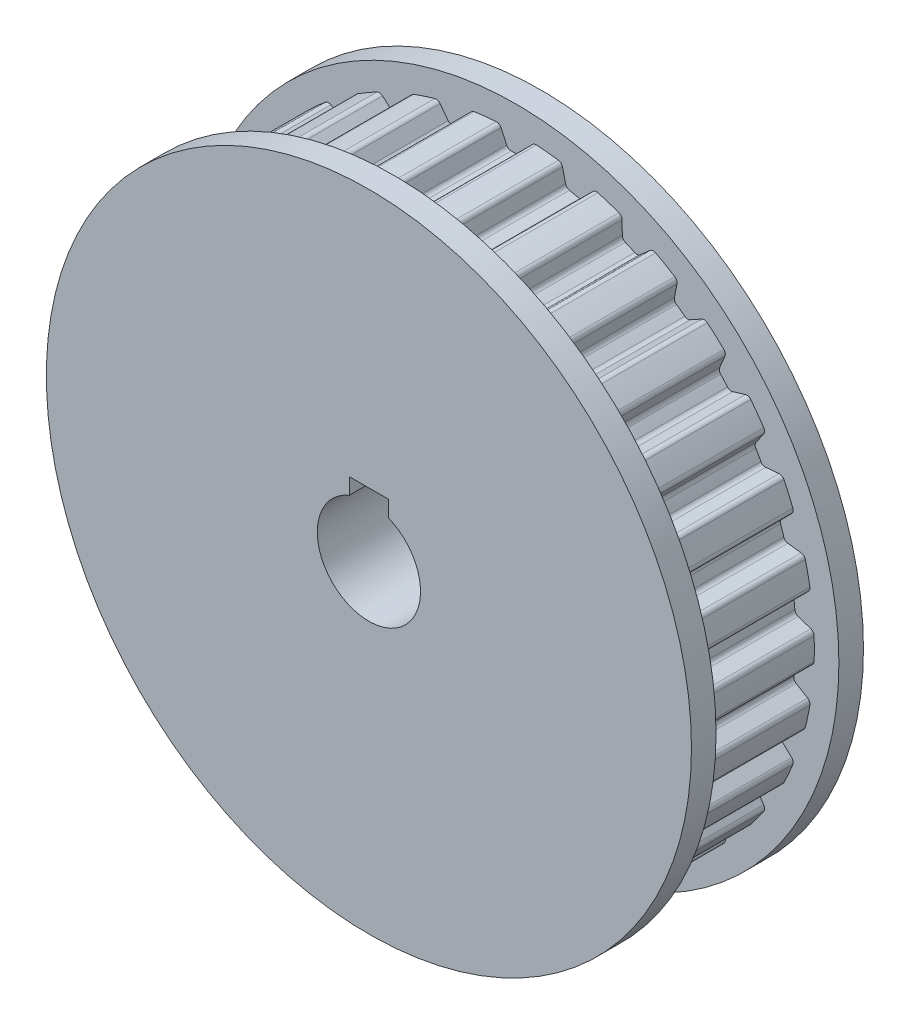
from build123d import *

# Parameters (mm, degrees)
CUT_EXTRUDE4_REACH             = 39.785
CUT_EXTRUDE4_DIRECTION_2_REACH = 39.785
CIRPATTERN1_COUNT              = 30
SKETCH2_R                      = 4.2
CUT_EXTRUDE1_DEPTH             = 40.682142756
SKETCH7_W                      = 3.2
SKETCH7_H                      = 5.2
CUT_EXTRUDE5_DEPTH             = 40.682142756
SKETCH3_R                      = 1.25
CUT_EXTRUDE2_DEPTH             = 40.682142756
SKETCH4_R                      = 1.25
CUT_EXTRUDE3_DEPTH             = 40.682142791


with BuildPart() as part:
    # Sketch1 → Revolve1 (revolve)
    with BuildSketch(Plane(origin=(0, 0, 0), x_dir=(1, 0, 0), z_dir=(0, 1, 0)), mode=Mode.PRIVATE) as revolve1_sk:
        Polygon((0, 14), (-26.255213327, 14), (-26.255213327, 12), (-24.255213327, 12), (-24.255213327, 2), (-26.255213327, 2), (-26.255213327, 0), (0, 0), align=None)
    revolve(revolve1_sk.sketch.rotate(Axis((0, 0, 0), (0, 0, -1)), 180), axis=Axis((0, 0, 0), (0, 0, -1)))

    # Cut-Extrude4: up to this face of the body (flat: up to its plane)
    cut_extrude4_end = Plane(part.part.faces().sort_by_distance((-25.512603752, 0, -12))[0])
    # Sketch6 → Cut-Extrude4 (cut, up to the picked face)
    with BuildSketch(Plane.XY.offset(-7), mode=Mode.PRIVATE) as cut_extrude4_sk1:
        with BuildLine():
            Line((-0.7897042, 22.982225242), (-1.250165079, 23.969686785))
            ThreePointArc((-1.250165079, 23.969686785), (-1.40930102, 24.14507185), (-1.639729464, 24.199724396))
            ThreePointArc((-1.639729464, 24.199724396), (0, 24.255213327), (1.639729464, 24.199724396))
            ThreePointArc((1.639729464, 24.199724396), (1.40930102, 24.14507185), (1.250165079, 23.969686785))
            Line((1.250165079, 23.969686785), (0.7897042, 22.982225242))
            ThreePointArc((0.7897042, 22.982225242), (0.638979774, 22.811947754), (0.419801648, 22.751340623))
            ThreePointArc((0.419801648, 22.751340623), (0, 22.755213327), (-0.419801648, 22.751340623))
            ThreePointArc((-0.419801648, 22.751340623), (-0.638979774, 22.811947754), (-0.7897042, 22.982225242))
        make_face()
    cut_extrude4_tool1 = split(extrude(cut_extrude4_sk1.sketch, amount=-CUT_EXTRUDE4_REACH, mode=Mode.PRIVATE), bisect_by=cut_extrude4_end, keep=Keep.BOTH, mode=Mode.PRIVATE)
    cut_extrude4 = cut_extrude4_tool1.solids().sort_by(Axis((0, 23.592076, -7), (0, 0, -1)))[0]
    add(cut_extrude4, mode=Mode.SUBTRACT)

    # Cut-Extrude4 direction 2: up to this face of the body (flat: up to its plane)
    cut_extrude4_direction_2_end = Plane(part.part.faces().sort_by_distance((-24.997822903, 0, -2))[0])
    # Sketch6 → Cut-Extrude4 direction 2 (cut, up to the picked face)
    with BuildSketch(Plane.XY.offset(-7), mode=Mode.PRIVATE) as cut_extrude4_direction_2_sk1:
        with BuildLine():
            Line((-0.7897042, 22.982225242), (-1.250165079, 23.969686785))
            ThreePointArc((-1.250165079, 23.969686785), (-1.40930102, 24.14507185), (-1.639729464, 24.199724396))
            ThreePointArc((-1.639729464, 24.199724396), (0, 24.255213327), (1.639729464, 24.199724396))
            ThreePointArc((1.639729464, 24.199724396), (1.40930102, 24.14507185), (1.250165079, 23.969686785))
            Line((1.250165079, 23.969686785), (0.7897042, 22.982225242))
            ThreePointArc((0.7897042, 22.982225242), (0.638979774, 22.811947754), (0.419801648, 22.751340623))
            ThreePointArc((0.419801648, 22.751340623), (0, 22.755213327), (-0.419801648, 22.751340623))
            ThreePointArc((-0.419801648, 22.751340623), (-0.638979774, 22.811947754), (-0.7897042, 22.982225242))
        make_face()
    cut_extrude4_direction_2_tool1 = split(extrude(cut_extrude4_direction_2_sk1.sketch, amount=CUT_EXTRUDE4_DIRECTION_2_REACH, mode=Mode.PRIVATE), bisect_by=cut_extrude4_direction_2_end, keep=Keep.BOTH, mode=Mode.PRIVATE)
    cut_extrude4_direction_2 = cut_extrude4_direction_2_tool1.solids().sort_by(Axis((0, 23.592076, -7), (0, 0, 1)))[0]
    add(cut_extrude4_direction_2, mode=Mode.SUBTRACT)

    # CirPattern1: Cut-Extrude4, Cut-Extrude4 direction 2 ×30 about axis
    cirpattern1_axis = Axis((0, 0, 0), (0, 0, 1))
    add([cut_extrude4.rotate(cirpattern1_axis, i * 360 / CIRPATTERN1_COUNT) for i in range(1, CIRPATTERN1_COUNT)], mode=Mode.SUBTRACT)
    add([cut_extrude4_direction_2.rotate(cirpattern1_axis, i * 360 / CIRPATTERN1_COUNT) for i in range(1, CIRPATTERN1_COUNT)], mode=Mode.SUBTRACT)

    # Sketch2 → Cut-Extrude1 (cut, through all)
    with BuildSketch(Plane.XY):
        Circle(SKETCH2_R)
    extrude(amount=-CUT_EXTRUDE1_DEPTH, mode=Mode.SUBTRACT)

    # Sketch7 → Cut-Extrude5 (cut, through all)
    with BuildSketch(Plane.XY):
        with Locations((0, 2.6)):
            Rectangle(SKETCH7_W, SKETCH7_H)
    extrude(amount=-CUT_EXTRUDE5_DEPTH, mode=Mode.SUBTRACT)

    # Sketch3 → Cut-Extrude2 (cut, through all)
    with BuildSketch(Plane(origin=(0, 0, 0), x_dir=(1, 0, 0), z_dir=(0, 1, 0))):
        with Locations(Location((0, 7, 0), (0, 0, 270))):
            Circle(SKETCH3_R)
    extrude(amount=-CUT_EXTRUDE2_DEPTH, mode=Mode.SUBTRACT)

    # Sketch4 → Cut-Extrude3 (cut, through all)
    with BuildSketch(Plane(origin=(0, 0, 0), x_dir=(0, 0, -1), z_dir=(1, 0, 0))):
        with Locations((7, 0)):
            Circle(SKETCH4_R)
    extrude(amount=-CUT_EXTRUDE3_DEPTH, mode=Mode.SUBTRACT)


solid = part.part
